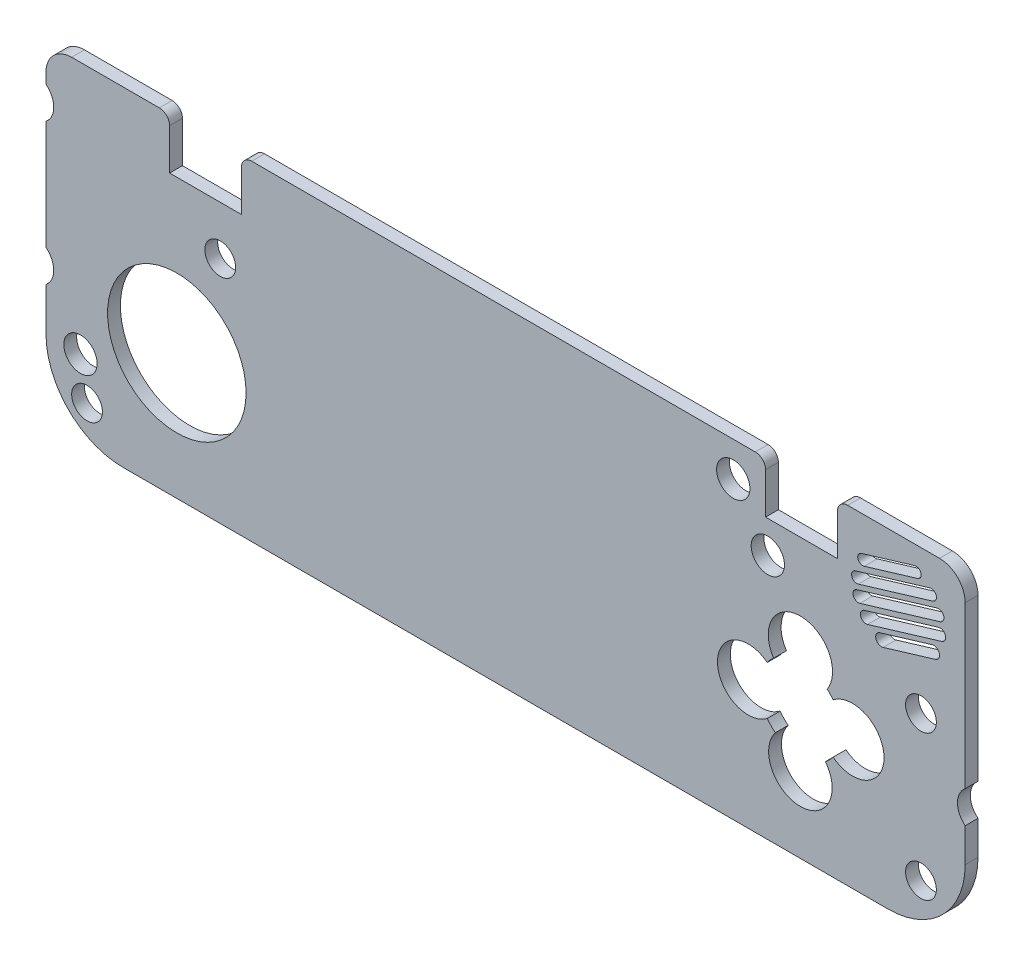
from build123d import *

# Parameters (mm, degrees)
BOSS_EXTRU_1_DEPTH       = 2.5
ENL_V_MAT_EXTRU_14_DEPTH = 10
JOYSTICK_R               = 13.5
ENL_V_MAT_EXTRU_2_DEPTH  = 2.5
ESQUISSE2_W              = 14
ESQUISSE2_H              = 10
ENL_V_MAT_EXTRU_3_DEPTH  = 10
CONG_1_R                 = 2
CONG_2_R                 = 2
ESQUISSE3_W              = 14
ESQUISSE3_H              = 10
ENL_V_MAT_EXTRU_4_DEPTH  = 10
CONG_3_R                 = 2
CONG_4_R                 = 2
ENL_V_MAT_EXTRU_8_DEPTH  = 10
ESQUISSE5_R              = 3
ESQUISSE5_R_2            = 3.25
ENL_V_MAT_EXTRU_9_DEPTH  = 10
ESQUISSE6_R              = 4
ENL_V_MAT_EXTRU_15_DEPTH = 10


with BuildPart() as part:
    # Esquisse1 → Boss.-Extru.1 (new body)
    with BuildSketch(Plane.XY):
        with BuildLine():
            Line((-89.203921136, 33.34478673), (79.966078864, 33.34478673))
            ThreePointArc((79.966078864, 33.34478673), (83.50161277, 31.880320636), (84.966078864, 28.34478673))
            Line((84.966078864, 28.34478673), (84.966078864, -15.88521327))
            ThreePointArc((84.966078864, -15.88521327), (80.572680581, -26.491814988), (69.966078864, -30.88521327))
            Line((69.966078864, -30.88521327), (-79.203921136, -30.88521327))
            ThreePointArc((-79.203921136, -30.88521327), (-89.810522854, -26.491814988), (-94.203921136, -15.88521327))
            Line((-94.203921136, -15.88521327), (-94.203921136, 28.34478673))
            ThreePointArc((-94.203921136, 28.34478673), (-92.739455042, 31.880320636), (-89.203921136, 33.34478673))
        make_face()
    extrude(amount=BOSS_EXTRU_1_DEPTH)

    # 12x12 Button → Enlèv. mat.-Extru.14 (cut)
    with BuildSketch(Plane.XY.offset(2.5)):
        with BuildLine():
            ThreePointArc((47.62517912, 0.314609491), (46.965240695, -0.322324083), (46.382477581, -1.030554452))
            ThreePointArc((46.382477581, -1.030554452), (36.687266101, -5.758353734), (46.387422405, -10.475999265))
            ThreePointArc((46.387422405, -10.475999265), (47.121070973, -11.343088385), (47.970121608, -12.097539697))
            ThreePointArc((47.970121608, -12.097539697), (52.846080853, -22.107917903), (57.722033666, -12.097536564))
            ThreePointArc((57.722033666, -12.097536564), (58.521539603, -11.393399627), (59.220393145, -10.589271343))
            ThreePointArc((59.220393145, -10.589271343), (69.146073474, -5.755216476), (59.220398192, -0.921151245))
            ThreePointArc((59.220398192, -0.921151245), (58.674503702, -0.275289323), (58.063482277, 0.309339821))
            ThreePointArc((58.063482276, 0.309339821), (52.849240894, 10.038221143), (47.62517912, 0.314609492))
        make_face()
    extrude(amount=-ENL_V_MAT_EXTRU_14_DEPTH, mode=Mode.SUBTRACT)

    # Joystick → Enlèv. mat.-Extru.2 (cut)
    with BuildSketch(Plane.XY.offset(2.5)):
        with Locations((-68.703921136, -6.32521327)):
            Circle(JOYSTICK_R)
    extrude(amount=-ENL_V_MAT_EXTRU_2_DEPTH, mode=Mode.SUBTRACT)

    # Esquisse2 → Enlèv. mat.-Extru.3 (cut)
    with BuildSketch(Plane.XY.offset(2.5)):
        with Locations((53.056078864, 28.34478673)):
            Rectangle(ESQUISSE2_W, ESQUISSE2_H)
    extrude(amount=-ENL_V_MAT_EXTRU_3_DEPTH, mode=Mode.SUBTRACT)

    # Congé1
    cong_1_edges = [part.edges().sort_by_distance(p)[0] for p in [
        (46.056078864, 33.34478673, 1.25),
    ]]
    fillet(cong_1_edges, radius=CONG_1_R)

    # Congé2
    cong_2_edges = [part.edges().sort_by_distance(p)[0] for p in [
        (60.056078864, 33.34478673, 1.25),
    ]]
    fillet(cong_2_edges, radius=CONG_2_R)

    # Esquisse3 → Enlèv. mat.-Extru.4 (cut)
    with BuildSketch(Plane.XY.offset(2.5)):
        with Locations((-63.103921136, 28.34478673)):
            Rectangle(ESQUISSE3_W, ESQUISSE3_H)
    extrude(amount=-ENL_V_MAT_EXTRU_4_DEPTH, mode=Mode.SUBTRACT)

    # Congé3
    cong_3_edges = [part.edges().sort_by_distance(p)[0] for p in [
        (-70.103921136, 33.34478673, 1.25),
    ]]
    fillet(cong_3_edges, radius=CONG_3_R)

    # Congé4
    cong_4_edges = [part.edges().sort_by_distance(p)[0] for p in [
        (-56.103921136, 33.34478673, 1.25),
    ]]
    fillet(cong_4_edges, radius=CONG_4_R)

    # Esquisse4 → Enlèv. mat.-Extru.8 (cut)
    with BuildSketch(Plane.XY.offset(2.5)):
        with BuildLine():
            Line((63.848163441, 19.991775112), (79.478036154, 24.706585194))
            ThreePointArc((79.478036154, 24.706585194), (80.785408643, 24.005170837), (80.083994286, 22.697798347))
            Line((80.083994286, 22.697798347), (64.454121573, 17.982988266))
            ThreePointArc((64.454121573, 17.982988266), (63.146749084, 18.684402623), (63.848163441, 19.991775112))
        make_face()
        with BuildLine():
            Line((63.539756046, 23.02230266), (78.059151304, 27.402133027))
            ThreePointArc((78.059151304, 27.402133027), (79.327394653, 26.721711723), (78.646973349, 25.453468374))
            Line((78.646973349, 25.453468374), (64.127578092, 21.073638007))
            ThreePointArc((64.127578092, 21.073638007), (62.859334743, 21.754059311), (63.539756046, 23.02230266))
        make_face()
        with BuildLine():
            Line((64.721267087, 26.554024385), (75.121728293, 29.691362753))
            ThreePointArc((75.121728293, 29.691362753), (76.350895216, 29.031906221), (75.691438685, 27.802739299))
            Line((75.691438685, 27.802739299), (65.290977478, 24.665400931))
            ThreePointArc((65.290977478, 24.665400931), (64.061810556, 25.324857462), (64.721267087, 26.554024385))
        make_face()
        with BuildLine():
            Line((65.314724126, 17.237366416), (79.779269942, 21.600651242))
            ThreePointArc((79.779269942, 21.600651242), (81.126757031, 20.877715126), (80.403820915, 19.530228036))
            Line((80.403820915, 19.530228036), (65.939275099, 15.166943211))
            ThreePointArc((65.939275099, 15.166943211), (64.591788009, 15.889879327), (65.314724126, 17.237366416))
        make_face()
        with BuildLine():
            Line((68.322797362, 14.963301678), (78.530507851, 18.042496065))
            ThreePointArc((78.530507851, 18.042496065), (79.931361718, 17.290928304), (79.179793957, 15.890074436))
            Line((79.179793957, 15.890074436), (68.972083468, 12.810880049))
            ThreePointArc((68.972083468, 12.810880049), (67.571229601, 13.562447811), (68.322797362, 14.963301678))
        make_face()
    extrude(amount=-ENL_V_MAT_EXTRU_8_DEPTH, mode=Mode.SUBTRACT)

    # Esquisse5 → Enlèv. mat.-Extru.9 (cut)
    with BuildSketch(Plane.XY.offset(2.5)):
        with Locations((76.346078864, -22.88521327)):
            Circle(ESQUISSE5_R)
        with Locations((-86.203921136, -23.53521327)):
            Circle(ESQUISSE5_R)
        with Locations((76.346078864, 5.34478673)):
            Circle(ESQUISSE5_R)
        with Locations((-60.233921136, 13.83478673)):
            Circle(ESQUISSE5_R)
        with Locations((-87.483921136, -15.91521327)):
            Circle(ESQUISSE5_R_2)
        with Locations((39.756078864, 26.62478673)):
            Circle(ESQUISSE5_R_2)
        with Locations((46.496078864, 17.10478673)):
            Circle(ESQUISSE5_R_2)
    extrude(amount=-ENL_V_MAT_EXTRU_9_DEPTH, mode=Mode.SUBTRACT)

    # Esquisse6 → Enlèv. mat.-Extru.15 (cut)
    with BuildSketch(Plane.XY.offset(2.5)):
        with Locations((-96.703921136, -4.38521327)):
            Circle(ESQUISSE6_R)
        with Locations((-96.703921136, 23.15478673)):
            Circle(ESQUISSE6_R)
        with Locations((87.466078864, -6.16521327)):
            Circle(ESQUISSE6_R)
    extrude(amount=-ENL_V_MAT_EXTRU_15_DEPTH, mode=Mode.SUBTRACT)


solid = part.part
